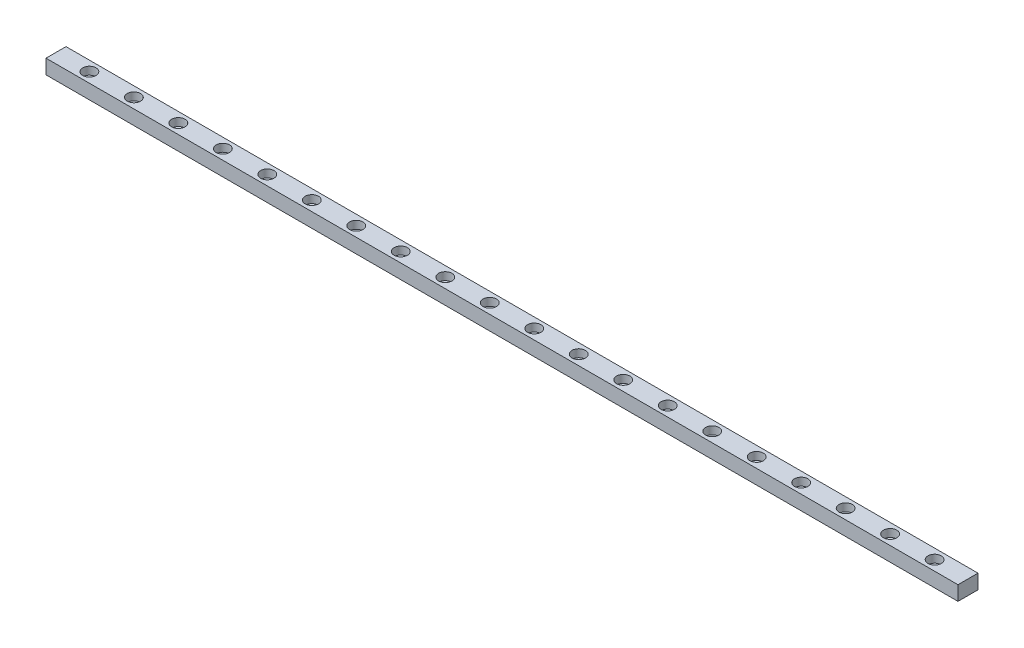
from build123d import *

# Parameters (mm, degrees)
SKETCH_2_W          = 9
SKETCH_2_H          = 6.5
EXTRUDE_1_DEPTH     = 410
SKETCH_3_R          = 3
CUT_EXTRUDE_1_DEPTH = 3.5
SKETCH_4_R          = 1.75
CUT_EXTRUDE_2_DEPTH = 411.076212429


with BuildPart() as part:
    # 草图2 → 凸台-拉伸1 (new body)
    with BuildSketch(Plane(origin=(0, 0, 0), x_dir=(0, 0, -1), z_dir=(1, 0, 0))):
        Rectangle(SKETCH_2_W, SKETCH_2_H)
    extrude(amount=EXTRUDE_1_DEPTH)

    # 草图3 → 切除-拉伸1 (cut)
    with BuildSketch(Plane(origin=(0, 3.25, 0), x_dir=(1, 0, 0), z_dir=(0, 1, 0))):
        with Locations(Location((15, 0, 0), (0, 0, 270))):
            Circle(SKETCH_3_R)
        with Locations(Location((35, 0, 0), (0, 0, 270))):
            Circle(SKETCH_3_R)
        with Locations(Location((55, 0, 0), (0, 0, 270))):
            Circle(SKETCH_3_R)
        with Locations(Location((75, 0, 0), (0, 0, 270))):
            Circle(SKETCH_3_R)
        with Locations(Location((95, 0, 0), (0, 0, 270))):
            Circle(SKETCH_3_R)
        with Locations(Location((115, 0, 0), (0, 0, 270))):
            Circle(SKETCH_3_R)
        with Locations(Location((135, 0, 0), (0, 0, 270))):
            Circle(SKETCH_3_R)
        with Locations(Location((155, 0, 0), (0, 0, 270))):
            Circle(SKETCH_3_R)
        with Locations(Location((175, 0, 0), (0, 0, 270))):
            Circle(SKETCH_3_R)
        with Locations(Location((195, 0, 0), (0, 0, 270))):
            Circle(SKETCH_3_R)
        with Locations(Location((215, 0, 0), (0, 0, 270))):
            Circle(SKETCH_3_R)
        with Locations(Location((235, 0, 0), (0, 0, 270))):
            Circle(SKETCH_3_R)
        with Locations(Location((255, 0, 0), (0, 0, 270))):
            Circle(SKETCH_3_R)
        with Locations(Location((275, 0, 0), (0, 0, 270))):
            Circle(SKETCH_3_R)
        with Locations(Location((295, 0, 0), (0, 0, 270))):
            Circle(SKETCH_3_R)
        with Locations(Location((315, 0, 0), (0, 0, 270))):
            Circle(SKETCH_3_R)
        with Locations(Location((335, 0, 0), (0, 0, 270))):
            Circle(SKETCH_3_R)
        with Locations(Location((355, 0, 0), (0, 0, 270))):
            Circle(SKETCH_3_R)
        with Locations(Location((375, 0, 0), (0, 0, 270))):
            Circle(SKETCH_3_R)
        with Locations(Location((395, 0, 0), (0, 0, 270))):
            Circle(SKETCH_3_R)
    extrude(amount=-CUT_EXTRUDE_1_DEPTH, mode=Mode.SUBTRACT)

    # 草图4 → 切除-拉伸2 (cut, through all)
    with BuildSketch(Plane(origin=(0, 3.25, 0), x_dir=(1, 0, 0), z_dir=(0, 1, 0))):
        with Locations(Location((15, 0, 0), (0, 0, 270))):
            Circle(SKETCH_4_R)
        with Locations(Location((35, 0, 0), (0, 0, 270))):
            Circle(SKETCH_4_R)
        with Locations(Location((55, 0, 0), (0, 0, 270))):
            Circle(SKETCH_4_R)
        with Locations(Location((75, 0, 0), (0, 0, 270))):
            Circle(SKETCH_4_R)
        with Locations(Location((95, 0, 0), (0, 0, 270))):
            Circle(SKETCH_4_R)
        with Locations(Location((115, 0, 0), (0, 0, 270))):
            Circle(SKETCH_4_R)
        with Locations(Location((135, 0, 0), (0, 0, 270))):
            Circle(SKETCH_4_R)
        with Locations(Location((155, 0, 0), (0, 0, 270))):
            Circle(SKETCH_4_R)
        with Locations(Location((175, 0, 0), (0, 0, 270))):
            Circle(SKETCH_4_R)
        with Locations(Location((195, 0, 0), (0, 0, 270))):
            Circle(SKETCH_4_R)
        with Locations(Location((215, 0, 0), (0, 0, 270))):
            Circle(SKETCH_4_R)
        with Locations(Location((235, 0, 0), (0, 0, 270))):
            Circle(SKETCH_4_R)
        with Locations(Location((255, 0, 0), (0, 0, 270))):
            Circle(SKETCH_4_R)
        with Locations(Location((275, 0, 0), (0, 0, 270))):
            Circle(SKETCH_4_R)
        with Locations(Location((295, 0, 0), (0, 0, 270))):
            Circle(SKETCH_4_R)
        with Locations(Location((315, 0, 0), (0, 0, 270))):
            Circle(SKETCH_4_R)
        with Locations(Location((335, 0, 0), (0, 0, 270))):
            Circle(SKETCH_4_R)
        with Locations(Location((355, 0, 0), (0, 0, 270))):
            Circle(SKETCH_4_R)
        with Locations(Location((375, 0, 0), (0, 0, 270))):
            Circle(SKETCH_4_R)
        with Locations(Location((395, 0, 0), (0, 0, 270))):
            Circle(SKETCH_4_R)
    extrude(amount=-CUT_EXTRUDE_2_DEPTH, mode=Mode.SUBTRACT)


solid = part.part
